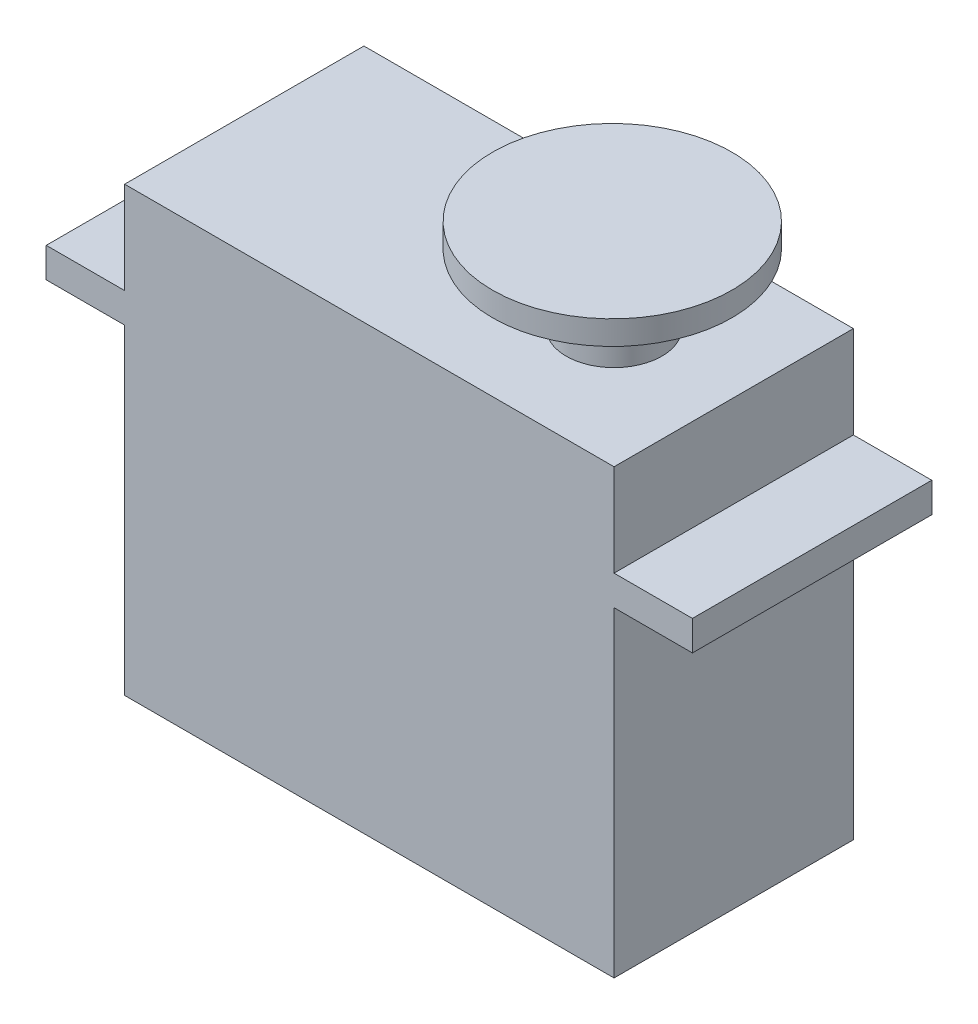
from build123d import *

# Parameters (mm, degrees)
SKETCH2_W           = 54
SKETCH2_H           = 20
BOSS_EXTRUDE1_DEPTH = 2.5
SKETCH4_W           = 40.9
SKETCH4_H           = 20
BOSS_EXTRUDE2_DEPTH = 26.8
SKETCH5_W           = 40.9
SKETCH5_H           = 20
BOSS_EXTRUDE3_DEPTH = 7.7
SKETCH6_R           = 4
BOSS_EXTRUDE4_DEPTH = 5.7
SKETCH7_R           = 10
BOSS_EXTRUDE5_DEPTH = 2


with BuildPart() as part:
    # Sketch2 → Boss-Extrude1 (new body)
    with BuildSketch(Plane(origin=(0, 0, 0), x_dir=(1, 0, 0), z_dir=(0, 1, 0))):
        Rectangle(SKETCH2_W, SKETCH2_H)
    extrude(amount=BOSS_EXTRUDE1_DEPTH)

    # Sketch4 → Boss-Extrude2 (add)
    with BuildSketch(Plane.XZ):
        Rectangle(SKETCH4_W, SKETCH4_H)
    extrude(amount=BOSS_EXTRUDE2_DEPTH)

    # Sketch5 → Boss-Extrude3 (add)
    with BuildSketch(Plane(origin=(0, 2.5, 0), x_dir=(1, 0, 0), z_dir=(0, 1, 0))):
        Rectangle(SKETCH5_W, SKETCH5_H)
    extrude(amount=BOSS_EXTRUDE3_DEPTH)

    # Sketch6 → Boss-Extrude4 (add)
    with BuildSketch(Plane(origin=(0, 10.2, 0), x_dir=(1, 0, 0), z_dir=(0, 1, 0))):
        with Locations(Location((10.45, 0, 0), (0, 0, 90))):
            Circle(SKETCH6_R)
    extrude(amount=BOSS_EXTRUDE4_DEPTH)

    # Sketch7 → Boss-Extrude5 (add)
    with BuildSketch(Plane(origin=(0, 15.9, 0), x_dir=(1, 0, 0), z_dir=(0, 1, 0))):
        with Locations(Location((10.301103248, 0, 0), (0, 0, 270))):
            Circle(SKETCH7_R)
    extrude(amount=BOSS_EXTRUDE5_DEPTH)


solid = part.part
